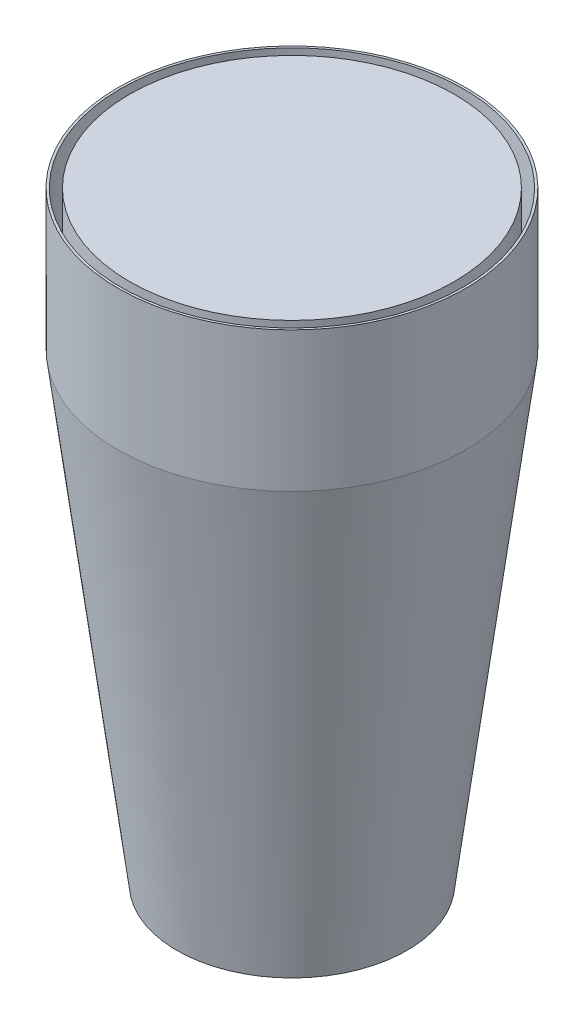
from build123d import *


with BuildPart() as part:
    # Sketch1 → rough engine (revolve)
    with BuildSketch(Plane.XY, mode=Mode.PRIVATE) as rough_engine_sk:
        Polygon((0, 0), (45, 0), (45, 200), (70, 200), (70, 260), (0, 260), align=None)
    revolve(rough_engine_sk.sketch.rotate(Axis((0, 260, 0), (0, -1, 0)), 180), axis=Axis((0, 260, 0), (0, -1, 0)))


with BuildPart() as body_2:
    # Sketch2 → Revolve2 (revolve)
    with BuildSketch(Plane.XY, mode=Mode.PRIVATE) as revolve2_sk:
        Polygon((75, 260), (75, 199.683748808), (49.638449337, 0), (48.630416014, 0), (74, 199.746999046), (74, 260), align=None)
    revolve(revolve2_sk.sketch.rotate(Axis((0, 260, 0), (0, -1, 0)), 180), axis=Axis((0, 260, 0), (0, -1, 0)))


solid = Compound([part.part, body_2.part])
